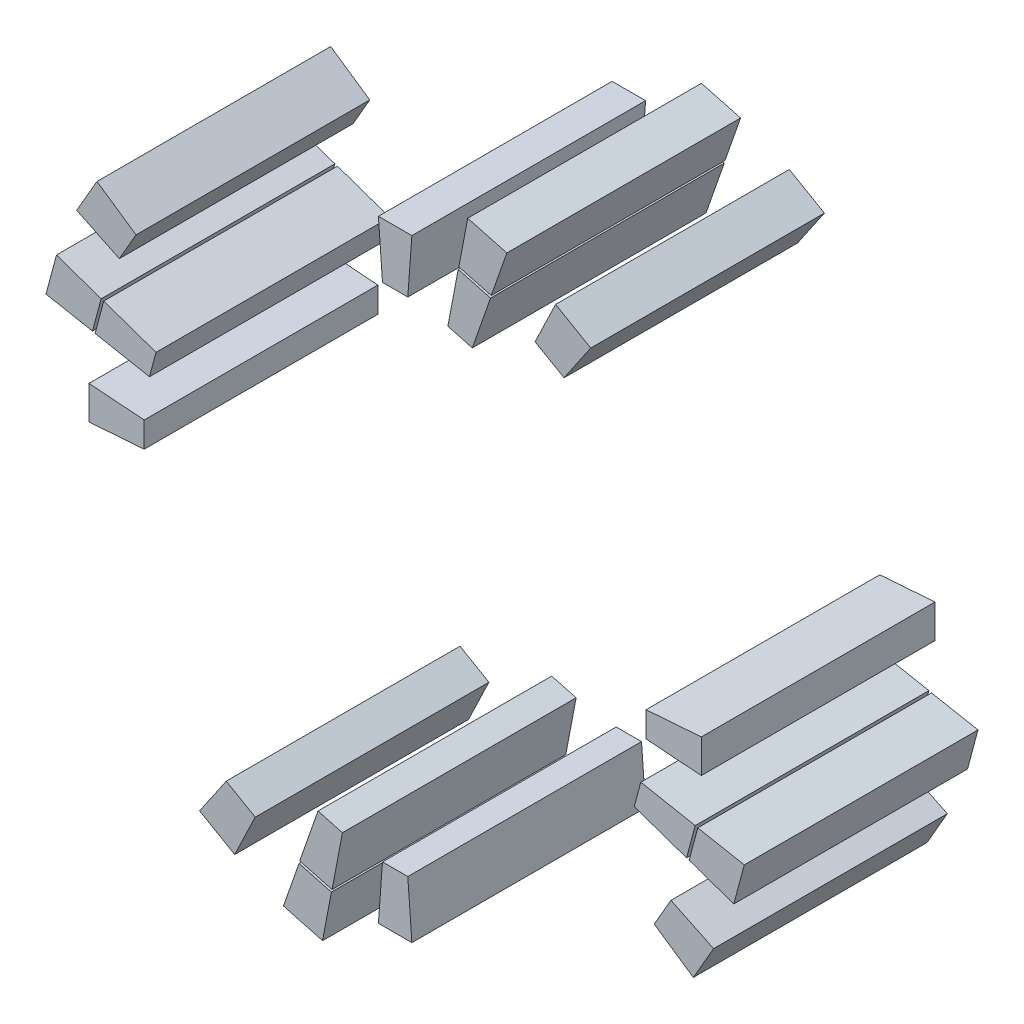
from build123d import *

# Parameters (mm, degrees)
COIL_SIDES_START    = -15
COIL_SIDES_DEPTH    = 30
COIL_SIDES_2_DEPTH  = 30
COIL_SIDES_3_DEPTH  = 30
COIL_SIDES_4_DEPTH  = 30
COIL_SIDES_5_DEPTH  = 30
COIL_SIDES_6_DEPTH  = 30
COIL_SIDES_7_DEPTH  = 30
COIL_SIDES_8_DEPTH  = 30
COIL_SIDES_9_DEPTH  = 30
COIL_SIDES_10_DEPTH = 30
COIL_SIDES_11_DEPTH = 30
COIL_SIDES_12_DEPTH = 30
COIL_SIDES_13_DEPTH = 30
COIL_SIDES_14_DEPTH = 30
COIL_SIDES_15_DEPTH = 30
COIL_SIDES_16_DEPTH = 30


with BuildPart() as part:
    # Эскиз1 → Coil_sides (new body)
    with BuildSketch(Plane.XY.offset(COIL_SIDES_START)):
        Polygon((32.209034059, -1.625), (39.3, -2.147321429), (39.3, 2.147321429), (32.209034059, 1.625), align=None)
    extrude(amount=COIL_SIDES_DEPTH)


with BuildPart() as body_2:
    # Эскиз1 → Coil_sides 2 (new body)
    with BuildSketch(Plane.XY.offset(COIL_SIDES_START)):
        Polygon((21.680577182, 33.25721836), (25.10166605, 38.277360953), (20.59833395, 40.877360953), (17.961307368, 35.404539789), align=None)
    extrude(amount=COIL_SIDES_2_DEPTH)


with BuildPart() as body_3:
    # Эскиз1 → Coil_sides 3 (new body)
    with BuildSketch(Plane.XY.offset(COIL_SIDES_START)):
        Polygon((9.905940906, 30.690956889), (12.245741698, 37.405117291), (8.097435247, 38.516652655), (6.766681971, 31.532118785), align=None)
    extrude(amount=COIL_SIDES_3_DEPTH)


with BuildPart() as body_4:
    # Эскиз1 → Coil_sides 4 (new body)
    with BuildSketch(Plane.XY.offset(COIL_SIDES_START)):
        Polygon((12.334227931, 37.735352408), (14.33943751, 43.469880744), (9.316623213, 44.815739779), (8.18592148, 38.846887771), align=None)
    extrude(amount=COIL_SIDES_4_DEPTH)


with BuildPart() as body_5:
    # Эскиз1 → Coil_sides 5 (new body)
    with BuildSketch(Plane.XY.offset(COIL_SIDES_START)):
        Polygon((1.625, 32.209034059), (2.147321429, 39.3), (-2.147321429, 39.3), (-1.625, 32.209034059), align=None)
    extrude(amount=COIL_SIDES_5_DEPTH)


with BuildPart() as body_6:
    # Эскиз1 → Coil_sides 6 (new body)
    with BuildSketch(Plane.XY.offset(COIL_SIDES_START)):
        Polygon((-33.25721836, 21.680577182), (-38.277360953, 25.10166605), (-40.877360953, 20.59833395), (-35.404539789, 17.961307368), align=None)
    extrude(amount=COIL_SIDES_6_DEPTH)


with BuildPart() as body_7:
    # Эскиз1 → Coil_sides 7 (new body)
    with BuildSketch(Plane.XY.offset(COIL_SIDES_START)):
        Polygon((-30.690956889, 9.905940906), (-37.405117291, 12.245741698), (-38.516652655, 8.097435247), (-31.532118785, 6.766681971), align=None)
    extrude(amount=COIL_SIDES_7_DEPTH)


with BuildPart() as body_8:
    # Эскиз1 → Coil_sides 8 (new body)
    with BuildSketch(Plane.XY.offset(COIL_SIDES_START)):
        Polygon((-37.735352408, 12.334227931), (-43.469880744, 14.33943751), (-44.815739779, 9.316623213), (-38.846887771, 8.18592148), align=None)
    extrude(amount=COIL_SIDES_8_DEPTH)


with BuildPart() as body_9:
    # Эскиз1 → Coil_sides 9 (new body)
    with BuildSketch(Plane.XY.offset(COIL_SIDES_START)):
        Polygon((-32.209034059, 1.625), (-39.3, 2.147321429), (-39.3, -2.147321429), (-32.209034059, -1.625), align=None)
    extrude(amount=COIL_SIDES_9_DEPTH)


with BuildPart() as body_10:
    # Эскиз1 → Coil_sides 10 (new body)
    with BuildSketch(Plane.XY.offset(COIL_SIDES_START)):
        Polygon((-21.680577182, -33.25721836), (-25.10166605, -38.277360953), (-20.59833395, -40.877360953), (-17.961307368, -35.404539789), align=None)
    extrude(amount=COIL_SIDES_10_DEPTH)


with BuildPart() as body_11:
    # Эскиз1 → Coil_sides 11 (new body)
    with BuildSketch(Plane.XY.offset(COIL_SIDES_START)):
        Polygon((-9.905940906, -30.690956889), (-12.245741698, -37.405117291), (-8.097435247, -38.516652655), (-6.766681971, -31.532118785), align=None)
    extrude(amount=COIL_SIDES_11_DEPTH)


with BuildPart() as body_12:
    # Эскиз1 → Coil_sides 12 (new body)
    with BuildSketch(Plane.XY.offset(COIL_SIDES_START)):
        Polygon((-12.334227931, -37.735352408), (-14.33943751, -43.469880744), (-9.316623213, -44.815739779), (-8.18592148, -38.846887771), align=None)
    extrude(amount=COIL_SIDES_12_DEPTH)


with BuildPart() as body_13:
    # Эскиз1 → Coil_sides 13 (new body)
    with BuildSketch(Plane.XY.offset(COIL_SIDES_START)):
        Polygon((-1.625, -32.209034059), (-2.147321429, -39.3), (2.147321429, -39.3), (1.625, -32.209034059), align=None)
    extrude(amount=COIL_SIDES_13_DEPTH)


with BuildPart() as body_14:
    # Эскиз1 → Coil_sides 14 (new body)
    with BuildSketch(Plane.XY.offset(COIL_SIDES_START)):
        Polygon((33.25721836, -21.680577182), (38.277360953, -25.10166605), (40.877360953, -20.59833395), (35.404539789, -17.961307368), align=None)
    extrude(amount=COIL_SIDES_14_DEPTH)


with BuildPart() as body_15:
    # Эскиз1 → Coil_sides 15 (new body)
    with BuildSketch(Plane.XY.offset(COIL_SIDES_START)):
        Polygon((30.690956889, -9.905940906), (37.405117291, -12.245741698), (38.516652655, -8.097435247), (31.532118785, -6.766681971), align=None)
    extrude(amount=COIL_SIDES_15_DEPTH)


with BuildPart() as body_16:
    # Эскиз1 → Coil_sides 16 (new body)
    with BuildSketch(Plane.XY.offset(COIL_SIDES_START)):
        Polygon((37.735352408, -12.334227931), (43.469880744, -14.33943751), (44.815739779, -9.316623213), (38.846887771, -8.18592148), align=None)
    extrude(amount=COIL_SIDES_16_DEPTH)


solid = Compound([part.part, body_2.part, body_3.part, body_4.part, body_5.part, body_6.part, body_7.part, body_8.part, body_9.part, body_10.part, body_11.part, body_12.part, body_13.part, body_14.part, body_15.part, body_16.part])
